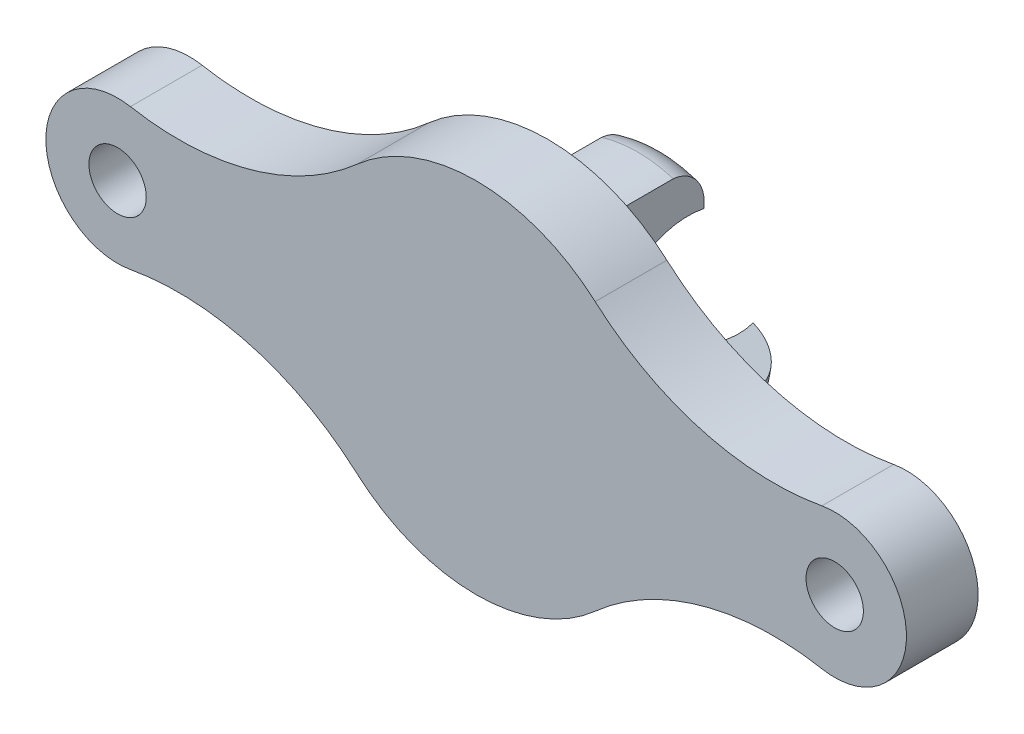
from build123d import *

# Parameters (mm, degrees)
CORTE_EXTRUS_O1_DEPTH    = 12.838758968
ESBO_O4_R                = 1.6
RESSALTO_EXTRUS_O1_DEPTH = 4


with BuildPart() as part:
    # Esboço1 → Revolução1 (revolve)
    with BuildSketch(Plane(origin=(0, 0, 0), x_dir=(1, 0, 0), z_dir=(0, 1, 0))):
        with BuildLine():
            Line((0, 0), (6.891534421, 0))
            Line((6.891534421, 0), (6.891534421, 5))
            ThreePointArc((6.891534421, 5), (6.180613943, 6.309516298), (4.743586175, 6.703460527))
            ThreePointArc((4.743586175, 6.703460527), (3.710745118, 2.736851933), (0, 0.995842151))
            Line((0, 0.995842151), (0, 0))
        make_face()
    revolve(axis=Axis((0, 0, 0), (0, 0, -1)))

    # Esboço3 → Corte-extrusão1 (cut, through all)
    with BuildSketch(Plane.XY):
        with BuildLine():
            Line((-2, 19.326317369), (-2, 1.734101615))
            Line((-2, 1.734101615), (-17.937282026, -7.467292453))
            ThreePointArc((-17.937282026, -7.467292453), (-16.698748021, 9.932691356), (-2, 19.326317369))
        make_face()
        with BuildLine():
            Line((2, 19.326317369), (2, 1.734101615))
            Line((2, 1.734101615), (17.937282026, -7.467292453))
            ThreePointArc((17.937282026, -7.467292453), (16.698748021, 9.932691356), (2, 19.326317369))
        make_face()
        with BuildLine():
            Line((0, -1.73), (-16.027252382, -10.983338477))
            ThreePointArc((-16.027252382, -10.983338477), (0, -19.429527607), (16.027252382, -10.983338477))
            Line((16.027252382, -10.983338477), (0, -1.73))
        make_face()
    extrude(amount=-CORTE_EXTRUS_O1_DEPTH, mode=Mode.SUBTRACT)

    # Esboço4 → Ressalto-extrusão1 (add)
    with BuildSketch(Plane.XY):
        with BuildLine():
            ThreePointArc((-6.64, -7.477325725), (0, -10), (6.64, -7.477325725))
            ThreePointArc((6.64, -7.477325725), (12.553949294, -4.249302623), (19.284210526, -3.935434592))
            ThreePointArc((19.284210526, -3.935434592), (24, 0), (19.284210526, 3.935434592))
            ThreePointArc((19.284210526, 3.935434592), (12.553949294, 4.249302623), (6.64, 7.477325725))
            ThreePointArc((6.64, 7.477325725), (0, 10), (-6.64, 7.477325725))
            ThreePointArc((-6.64, 7.477325725), (-12.553949294, 4.249302623), (-19.284210526, 3.935434592))
            ThreePointArc((-19.284210526, 3.935434592), (-24, 0), (-19.284210526, -3.935434592))
            ThreePointArc((-19.284210526, -3.935434592), (-12.553949294, -4.249302623), (-6.64, -7.477325725))
        make_face()
        with Locations((20, 0)):
            Circle(ESBO_O4_R, mode=Mode.SUBTRACT)
        with Locations((-20, 0)):
            Circle(ESBO_O4_R, mode=Mode.SUBTRACT)
    extrude(amount=RESSALTO_EXTRUS_O1_DEPTH)


solid = part.part
